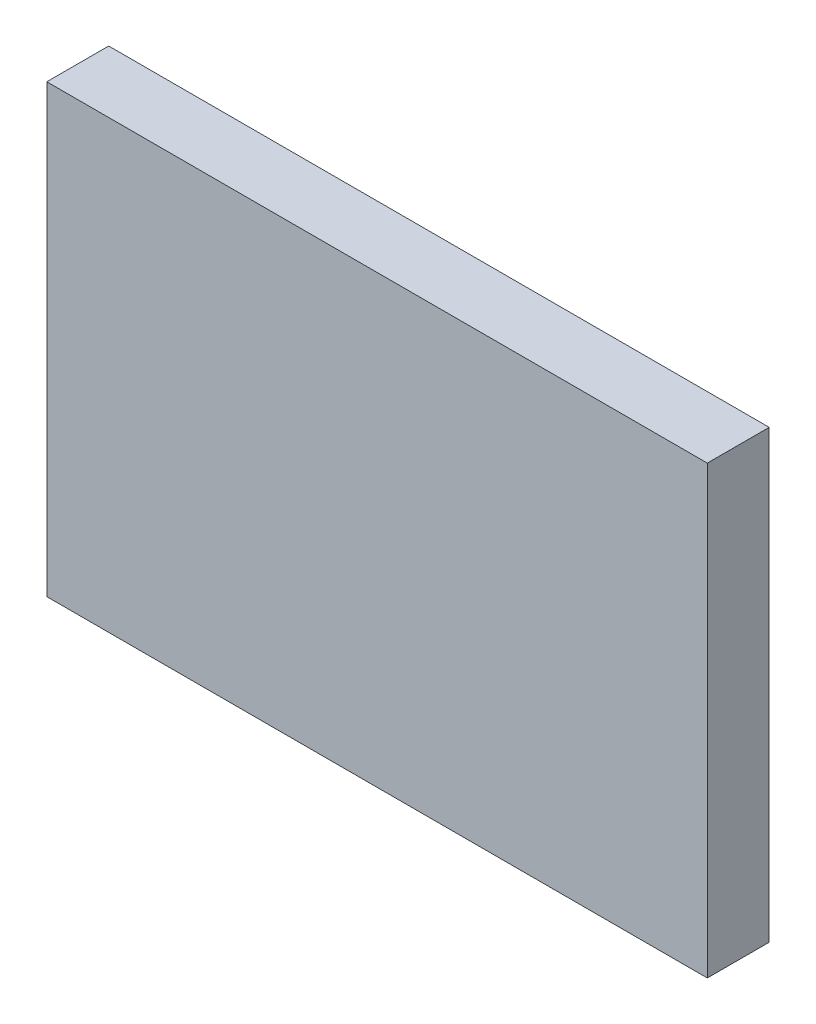
from build123d import *

# Parameters (mm, degrees)
CROQUIS1_W              = 80.5
CROQUIS1_H              = 53.3
SALIENTE_EXTRUIR1_DEPTH = 5
CROQUIS2_W              = 96
CROQUIS2_H              = 64.811604732
SALIENTE_EXTRUIR2_DEPTH = 4
CROQUIS3_W              = 10
CROQUIS3_H              = 15
CORTAR_EXTRUIR1_DEPTH   = 6.8
CROQUIS4_W              = 5.8
CROQUIS4_H              = 2.5
CROQUIS4_W_2            = 2.7
SALIENTE_EXTRUIR3_DEPTH = 7
CROQUIS5_W              = 70
CROQUIS5_H              = 35
CORTAR_EXTRUIR2_DEPTH   = 5


with BuildPart() as part:
    # Croquis1 → Saliente-Extruir1 (new body)
    with BuildSketch(Plane.XY):
        Polygon((-43.45, 24), (-40.25, 24), (-40.25, 29.3), (-48, 29.3), (-48, -35.511604732), (48, -35.511604732), (48, 29.3), (40.25, 29.3), (40.25, 24), (43.45, 24), (43.45, -30.7), (-43.45, -30.7), align=None)
        with Locations((0, 2.65)):
            Rectangle(CROQUIS1_W, CROQUIS1_H)
    extrude(amount=SALIENTE_EXTRUIR1_DEPTH)

    # Croquis2 → Saliente-Extruir2 (add)
    with BuildSketch(Plane.XY.offset(5)):
        with Locations((0, -3.105802366)):
            Rectangle(CROQUIS2_W, CROQUIS2_H)
    extrude(amount=SALIENTE_EXTRUIR2_DEPTH)

    # Croquis3 → Cortar-Extruir1 (cut)
    with BuildSketch(Plane(origin=(0, 0, 0), x_dir=(-1, 0, 0), z_dir=(0, 0, -1))):
        with Locations((12.95, -31.5)):
            Rectangle(CROQUIS3_W, CROQUIS3_H)
    extrude(amount=-CORTAR_EXTRUIR1_DEPTH, mode=Mode.SUBTRACT)

    # Croquis4 → Saliente-Extruir3 (add)
    with BuildSketch(Plane(origin=(0, 0, 0), x_dir=(-1, 0, 0), z_dir=(0, 0, -1))):
        with Locations((40.55, -29.45)):
            Rectangle(CROQUIS4_W, CROQUIS4_H)
        with Locations((-42.1, -29.45)):
            Rectangle(CROQUIS4_W_2, CROQUIS4_H)
    extrude(amount=-SALIENTE_EXTRUIR3_DEPTH)

    # Croquis5 → Cortar-Extruir2 (cut)
    with BuildSketch(Plane(origin=(0, 0, 0), x_dir=(-1, 0, 0), z_dir=(0, 0, -1))):
        Rectangle(CROQUIS5_W, CROQUIS5_H)
    extrude(amount=-CORTAR_EXTRUIR2_DEPTH, mode=Mode.SUBTRACT)


solid = part.part
